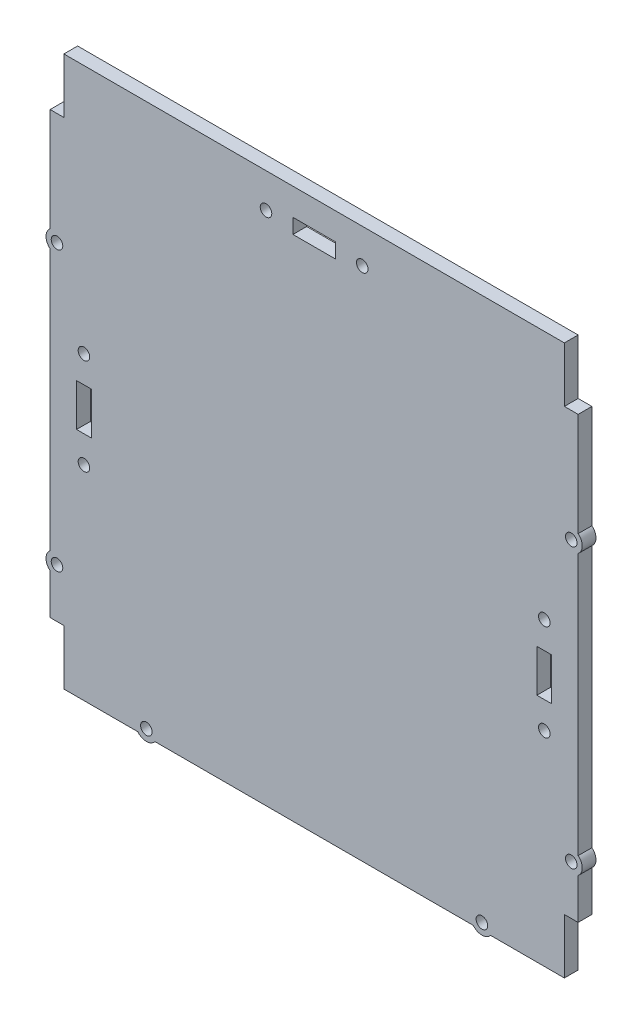
from build123d import *

# Parameters (mm, degrees)
BOSS_EXTRUDE1_DEPTH = 5
SKETCH2_R           = 2.1
CUT_EXTRUDE1_DEPTH  = 10
BOSS_EXTRUDE2_DEPTH = 5
BOSS_EXTRUDE3_DEPTH = 5
SKETCH5_R           = 2.1
CUT_EXTRUDE2_DEPTH  = 5
BOSS_EXTRUDE4_DEPTH = 5
SKETCH10_W          = 5.4
SKETCH10_H          = 15.4
SKETCH10_W_2        = 15.4
SKETCH10_H_2        = 5.4
SKETCH10_W_3        = 15
SKETCH10_H_3        = 5
CUT_EXTRUDE7_DEPTH  = 10
SKETCH11_W          = 15
SKETCH11_H          = 5
CUT_EXTRUDE8_DEPTH  = 10
SKETCH12_R          = 2.1
CUT_EXTRUDE9_DEPTH  = 10


with BuildPart() as part:
    # Sketch1 → Boss-Extrude1 (new body)
    with BuildSketch(Plane.XY):
        Polygon((-182, 200), (-182, 180), (-187, 180), (-187, 20), (-182, 20), (-182, 0), (0, 0), (0, 20), (5, 20), (5, 180), (0, 180), (0, 200), align=None)
    extrude(amount=BOSS_EXTRUDE1_DEPTH)

    # Sketch2 → Cut-Extrude1 (cut)
    with BuildSketch(Plane(origin=(0, 0, 0), x_dir=(-1, 0, 0), z_dir=(0, 0, -1))):
        with Locations((-2.5, 139.3)):
            Circle(SKETCH2_R)
        with Locations((-2.5, 37.9)):
            Circle(SKETCH2_R)
        with Locations(Location((184.5, 37.9, 0), (0, 0, 180))):
            Circle(SKETCH2_R)
        with Locations(Location((184.5, 139.3, 0), (0, 0, 180))):
            Circle(SKETCH2_R)
    extrude(amount=-CUT_EXTRUDE1_DEPTH, mode=Mode.SUBTRACT)

    # Sketch3 → Boss-Extrude2 (add)
    with BuildSketch(Plane(origin=(0, 0, 0), x_dir=(-1, 0, 0), z_dir=(0, 0, -1))):
        with BuildLine():
            Line((-5, 136.177501001), (-5, 142.422498999))
            ThreePointArc((-5, 142.422498999), (-6.5, 139.3), (-5, 136.177501001))
        make_face()
    boss_extrude2 = extrude(amount=-BOSS_EXTRUDE2_DEPTH)

    # Sketch4 → Boss-Extrude3 (add)
    with BuildSketch(Plane(origin=(0, 0, 0), x_dir=(-1, 0, 0), z_dir=(0, 0, -1))):
        with BuildLine():
            Line((-5, 34.777501001), (-5, 41.022498999))
            ThreePointArc((-5, 41.022498999), (-6.5, 37.9), (-5, 34.777501001))
        make_face()
    boss_extrude3 = extrude(amount=-BOSS_EXTRUDE3_DEPTH)

    # Mirror1: Boss-Extrude2, Boss-Extrude3 across plane
    add(boss_extrude2.mirror(Plane.ZY.offset(91)))
    add(boss_extrude3.mirror(Plane.ZY.offset(91)))

    # Sketch5 → Cut-Extrude2 (cut)
    with BuildSketch(Plane(origin=(0, 0, 0), x_dir=(-1, 0, 0), z_dir=(0, 0, -1))):
        with Locations((30, 2.5)):
            Circle(SKETCH5_R)
        with Locations((152, 2.5)):
            Circle(SKETCH5_R)
    extrude(amount=-CUT_EXTRUDE2_DEPTH, mode=Mode.SUBTRACT)

    # Sketch6 → Boss-Extrude4 (add)
    with BuildSketch(Plane(origin=(0, 0, 0), x_dir=(-1, 0, 0), z_dir=(0, 0, -1))):
        with BuildLine():
            Line((155.122498999, 0), (148.877501001, 0))
            ThreePointArc((148.877501001, 0), (152, -1.5), (155.122498999, 0))
        make_face()
        with BuildLine():
            Line((33.122498999, 0), (26.877501001, 0))
            ThreePointArc((26.877501001, 0), (30, -1.5), (33.122498999, 0))
        make_face()
    extrude(amount=-BOSS_EXTRUDE4_DEPTH)

    # Sketch10 → Cut-Extrude7 (cut)
    # profile 1 of 4: a face of its own
    with BuildSketch(Plane(origin=(0, 0, 0), x_dir=(-1, 0, 0), z_dir=(0, 0, -1))):
        with Locations((7.3, 91.747126042)):
            Rectangle(SKETCH10_W, SKETCH10_H)
    # profile 2 of 4: a face of its own
    with BuildSketch(Plane(origin=(0, 0, 0), x_dir=(-1, 0, 0), z_dir=(0, 0, -1))):
        with Locations((174.7, 91.747126042)):
            Rectangle(SKETCH10_W, SKETCH10_H)
    # profile 3 of 4: a face of its own
    with BuildSketch(Plane(origin=(0, 0, 0), x_dir=(-1, 0, 0), z_dir=(0, 0, -1))):
        with Locations((91, -4.005747915)):
            Rectangle(SKETCH10_W_2, SKETCH10_H_2)
        with Locations((91, -4.005747915)):
            Rectangle(SKETCH10_W_3, SKETCH10_H_3, mode=Mode.SUBTRACT)
    # profile 4 of 4: a face of its own
    with BuildSketch(Plane(origin=(0, 0, 0), x_dir=(-1, 0, 0), z_dir=(0, 0, -1))):
        with Locations((91, 187.5)):
            Rectangle(SKETCH10_W_2, SKETCH10_H_2)
        with Locations((91, 187.5)):
            Rectangle(SKETCH10_W_3, SKETCH10_H_3, mode=Mode.SUBTRACT)
    extrude(amount=-CUT_EXTRUDE7_DEPTH, mode=Mode.SUBTRACT)


with BuildPart() as cut_extrude7_piece_1:
    # of the separate pieces the step leaves, piece 1, a body of its own (cut_extrude7_pieces)
    add(part.part.solids().sort_by_distance((-182, 200, 0))[0])

    # Sketch12 → Cut-Extrude9 (cut)
    with BuildSketch(Plane.XY.offset(5)):
        with Locations((-108.5, 187.5)):
            Circle(SKETCH12_R)
        with Locations((-73.5, 187.5)):
            Circle(SKETCH12_R)
        with Locations((-73.5, -4.005747915)):
            Circle(SKETCH12_R)
        with Locations((-108.5, -4.005747915)):
            Circle(SKETCH12_R)
        with Locations((-174.7, 109.247126042)):
            Circle(SKETCH12_R)
        with Locations((-174.7, 74.247126042)):
            Circle(SKETCH12_R)
        with Locations((-7.3, 74.247126042)):
            Circle(SKETCH12_R)
        with Locations((-7.3, 109.247126042)):
            Circle(SKETCH12_R)
    extrude(amount=-CUT_EXTRUDE9_DEPTH, mode=Mode.SUBTRACT)


with BuildPart() as cut_extrude7_piece_2:
    # of the separate pieces the step leaves, piece 2, a body of its own (cut_extrude7_pieces)
    add(part.part.solids().sort_by_distance((-98.5, 185, 0))[0])

    # Sketch11 → Cut-Extrude8 (cut)
    with BuildSketch(Plane.XY.offset(5)):
        with Locations((-91, 12.499999997)):
            Rectangle(SKETCH11_W, SKETCH11_H)
        with Locations((-91, 187.5)):
            Rectangle(SKETCH11_W, SKETCH11_H)
    extrude(amount=-CUT_EXTRUDE8_DEPTH, mode=Mode.SUBTRACT)


solid = cut_extrude7_piece_1.part
